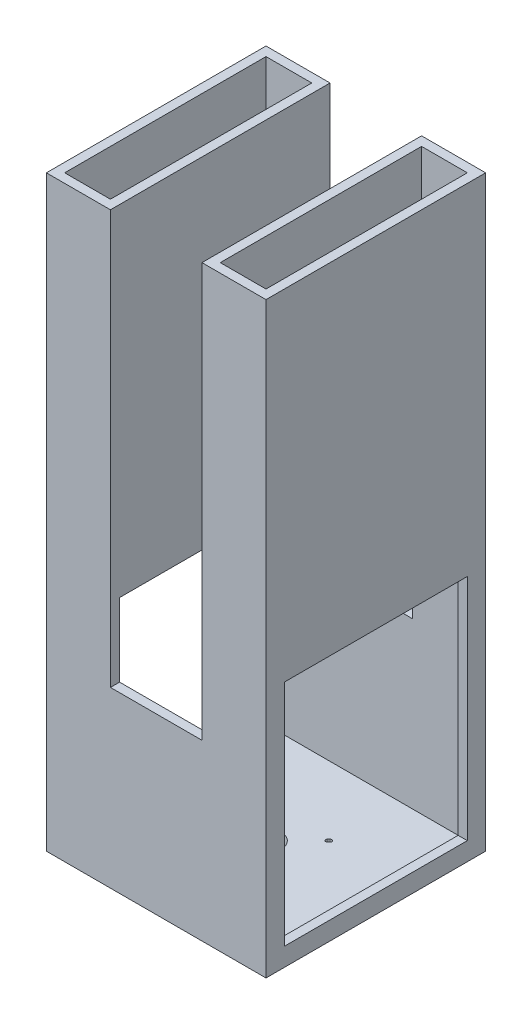
from build123d import *

# Parameters (mm, degrees)
SKETCH1_W           = 240
SKETCH1_H           = 240
SKETCH1_W_2         = 220
SKETCH1_H_2         = 220
BOSS_EXTRUDE1_DEPTH = 260
SKETCH2_W           = 240
SKETCH2_H           = 240
BOSS_EXTRUDE2_DEPTH = 10
SKETCH3_R           = 16.5
CUT_EXTRUDE1_DEPTH  = 20
CUT_EXTRUDE3_DEPTH  = 10
SKETCH8_W           = 100
SKETCH8_H           = 108.812952024
CUT_EXTRUDE4_DEPTH  = 296
BOSS_EXTRUDE4_DEPTH = 372
SKETCH10_W          = 200
SKETCH10_H          = 250
CUT_EXTRUDE5_DEPTH  = 372
SKETCH11_W          = 10
SKETCH11_H          = 220
BOSS_EXTRUDE6_DEPTH = 362
SKETCH12_W          = 70
SKETCH12_H          = 240
BOSS_EXTRUDE7_DEPTH = 10


with BuildPart() as part:
    # Sketch1 → Boss-Extrude1 (new body)
    with BuildSketch(Plane(origin=(0, 0, 0), x_dir=(1, 0, 0), z_dir=(0, 1, 0))):
        Rectangle(SKETCH1_W, SKETCH1_H)
        Rectangle(SKETCH1_W_2, SKETCH1_H_2, mode=Mode.SUBTRACT)
    extrude(amount=BOSS_EXTRUDE1_DEPTH)

    # Sketch2 → Boss-Extrude2 (add)
    with BuildSketch(Plane.XZ):
        Rectangle(SKETCH2_W, SKETCH2_H)
    extrude(amount=BOSS_EXTRUDE2_DEPTH)

    # Sketch3 → Cut-Extrude1 (cut)
    with BuildSketch(Plane.XZ.offset(10)):
        with Locations(Location((0, 0, 0), (0, 0, 270))):
            Circle(SKETCH3_R)
    extrude(amount=-CUT_EXTRUDE1_DEPTH, mode=Mode.SUBTRACT)

    # Sketch7 → Cut-Extrude3 (cut)
    with BuildSketch(Plane(origin=(0, -10, 0), x_dir=(-1, 0, 0), z_dir=(0, -1, 0))):
        with BuildLine():
            Line((-36.415999231, 33.587572106), (-35.001785669, 32.173358544))
            ThreePointArc((-35.001785669, 32.173358544), (-32.173358544, 32.173358544), (-32.173358544, 35.001785669))
            Line((-32.173358544, 35.001785669), (-33.587572106, 36.415999231))
            ThreePointArc((-33.587572106, 36.415999231), (-36.415999231, 36.415999231), (-36.415999231, 33.587572106))
        make_face()
        with BuildLine():
            Line((32.173358544, 35.001785669), (33.587572106, 36.415999231))
            ThreePointArc((33.587572106, 36.415999231), (36.415999231, 36.415999231), (36.415999231, 33.587572106))
            Line((36.415999231, 33.587572106), (35.001785669, 32.173358544))
            ThreePointArc((35.001785669, 32.173358544), (32.173358544, 32.173358544), (32.173358544, 35.001785669))
        make_face()
        with BuildLine():
            Line((35.001785669, -32.173358544), (36.415999231, -33.587572106))
            ThreePointArc((36.415999231, -33.587572106), (36.415999231, -36.415999231), (33.587572106, -36.415999231))
            Line((33.587572106, -36.415999231), (32.173358544, -35.001785669))
            ThreePointArc((32.173358544, -35.001785669), (32.173358544, -32.173358544), (35.001785669, -32.173358544))
        make_face()
        with BuildLine():
            Line((-36.415999231, -33.587572106), (-35.001785669, -32.173358544))
            ThreePointArc((-35.001785669, -32.173358544), (-32.173358544, -32.173358544), (-32.173358544, -35.001785669))
            Line((-32.173358544, -35.001785669), (-33.587572106, -36.415999231))
            ThreePointArc((-33.587572106, -36.415999231), (-36.415999231, -36.415999231), (-36.415999231, -33.587572106))
        make_face()
    extrude(amount=-CUT_EXTRUDE3_DEPTH, mode=Mode.SUBTRACT)

    # Sketch8 → Cut-Extrude4 (cut)
    with BuildSketch(Plane.XY.offset(120)):
        with Locations((0, 234.406476012)):
            Rectangle(SKETCH8_W, SKETCH8_H)
    extrude(amount=-CUT_EXTRUDE4_DEPTH, mode=Mode.SUBTRACT)

    # Sketch9 → Boss-Extrude4 (add)
    with BuildSketch(Plane(origin=(0, 260, 0), x_dir=(1, 0, 0), z_dir=(0, 1, 0))):
        Polygon((-50, 110), (-50, 120), (-120, 120), (-120, -120), (-50, -120), (-50, -110), (-110, -110), (-110, 110), align=None)
        Polygon((50, 110), (50, 120), (120, 120), (120, -120), (50, -120), (50, -110), (110, -110), (110, 110), align=None)
    extrude(amount=BOSS_EXTRUDE4_DEPTH)

    # Sketch10 → Cut-Extrude5 (cut)
    with BuildSketch(Plane(origin=(120, 0, 0), x_dir=(0, 0, -1), z_dir=(1, 0, 0))):
        with Locations((0, 135)):
            Rectangle(SKETCH10_W, SKETCH10_H)
    extrude(amount=-CUT_EXTRUDE5_DEPTH, mode=Mode.SUBTRACT)

    # Sketch11 → Boss-Extrude6 (add)
    with BuildSketch(Plane(origin=(0, 632, 0), x_dir=(1, 0, 0), z_dir=(0, 1, 0))):
        with Locations((55, 0)):
            Rectangle(SKETCH11_W, SKETCH11_H)
        with Locations((-55, 0)):
            Rectangle(SKETCH11_W, SKETCH11_H)
    extrude(amount=-BOSS_EXTRUDE6_DEPTH)

    # Sketch12 → Boss-Extrude7 (add)
    with BuildSketch(Plane.XZ.offset(-270)):
        with Locations((-85, 0)):
            Rectangle(SKETCH12_W, SKETCH12_H)
        with Locations((85, 0)):
            Rectangle(SKETCH12_W, SKETCH12_H)
    extrude(amount=BOSS_EXTRUDE7_DEPTH)


solid = part.part
